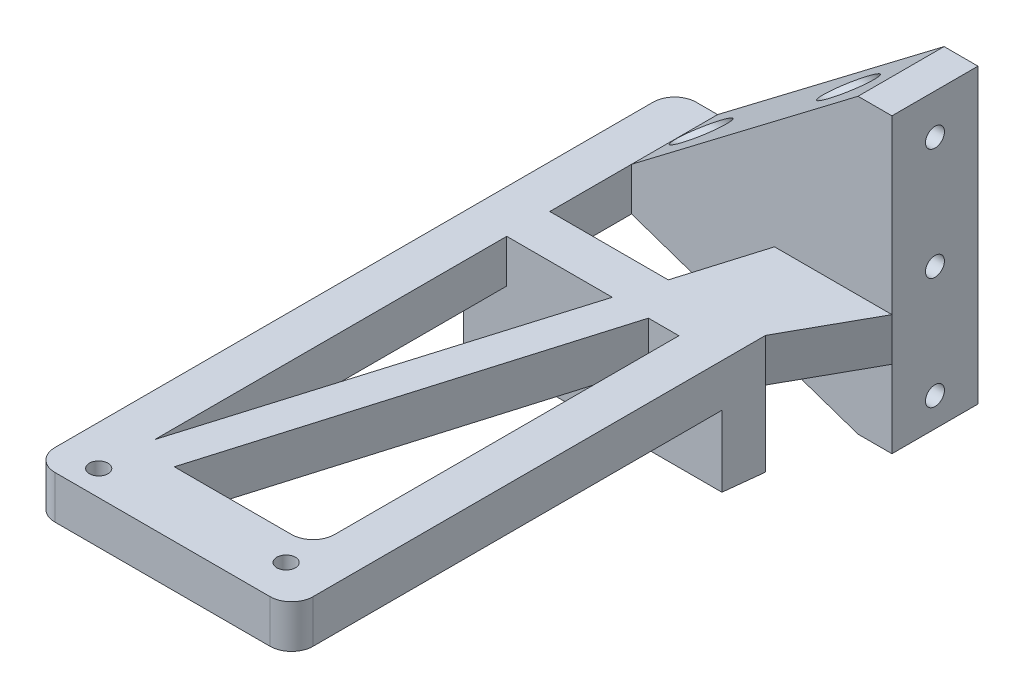
from build123d import *

# Parameters (mm, degrees)
EXTRUDE_1_DEPTH                 = 10
SKETCH_4_W                      = 7.875
SKETCH_4_H                      = 20
EXTRUDE_2_DEPTH                 = 40
CUT_EXTRUDE_1_REACH             = 116.35
SKETCH_5_R                      = 2.2
CUT_EXTRUDE_1_DIRECTION_2_DEPTH = 53
CUT_EXTRUDE_2_REACH             = 107.272
SKETCH_6_R                      = 2.15
FILLET_1_R                      = 5
FILLET_2_R                      = 5
SKETCH_7_W                      = 7.875
SKETCH_7_H                      = 20
EXTRUDE_3_DEPTH                 = 18
CUT_EXTRUDE_3_REACH             = 116.35
SKETCH_8_R                      = 2.2
EXTRUDE_8_DEPTH                 = 20
SKETCH_15_W                     = 52.625
SKETCH_15_H                     = 20
EXTRUDE_9_DEPTH                 = 40
CUT_EXTRUDE_START               = -7.875
SKETCH_14_R                     = 4.5
CUT_EXTRUDE_8_DEPTH             = 54
CUT_EXTRUDE_10_DEPTH            = 20
EXTRUDE_10_DEPTH                = 10
EXTRUDE_11_DEPTH                = 17.5
CUT_EXTRUDE_11_DEPTH            = 64


with BuildPart() as part:
    # 草图1 → 凸台-拉伸1 (new body)
    with BuildSketch(Plane(origin=(0, 0, 0), x_dir=(1, 0, 0), z_dir=(0, 1, 0))):
        Polygon((5.931150433, 81.572237736), (53.180774799, 81.572237736), (53.180774799, 61.572237736), (42.680774799, 42.721022935), (42.680774799, 31.757290204), (42.680774799, -57.600660719), (42.680774799, -67.427762264), (0.431150433, -67.427762264), (-17.319225201, -67.427762264), (-17.319225201, 81.572237736), align=None)
        Polygon((47.930774799, 61.572237736), (42.680774799, 61.572237736), (42.680774799, 52.689495612), align=None, mode=Mode.SUBTRACT)
        Polygon((25.906315323, 61.572237736), (-7.319225201, 61.572237736), (-7.319225201, -49.220735683), align=None, mode=Mode.SUBTRACT)
        Polygon((0.431150433, -52.427762264), (32.680774799, -52.427762264), (32.680774799, 56.508121895), align=None, mode=Mode.SUBTRACT)
    extrude(amount=EXTRUDE_1_DEPTH)

    # 草图4 → 凸台-拉伸2 (add)
    with BuildSketch(Plane(origin=(0, 10, 0), x_dir=(1, 0, 0), z_dir=(0, 1, 0))):
        with Locations((49.243274799, 71.572237736)):
            Rectangle(SKETCH_4_W, SKETCH_4_H)
    extrude(amount=EXTRUDE_2_DEPTH)

    # 草图5 → 切除-拉伸1 (cut, up to next)
    with BuildSketch(Plane.ZY.offset(-45.305774799), mode=Mode.PRIVATE) as cut_extrude_1_sk1:
        with Locations(Location((-71.572237736, 14.7, 0), (0, 0, 180))):
            Circle(SKETCH_5_R)
    cut_extrude_1_tool1 = extrude(cut_extrude_1_sk1.sketch, amount=-CUT_EXTRUDE_1_REACH, mode=Mode.PRIVATE) & part.part
    # 草图5 → 切除-拉伸1 (cut, up to next)
    with BuildSketch(Plane.ZY.offset(-45.305774799), mode=Mode.PRIVATE) as cut_extrude_1_sk2:
        with Locations(Location((-71.572237736, 40.7, 0), (0, 0, 180))):
            Circle(SKETCH_5_R)
    cut_extrude_1_tool2 = extrude(cut_extrude_1_sk2.sketch, amount=-CUT_EXTRUDE_1_REACH, mode=Mode.PRIVATE) & part.part
    add(cut_extrude_1_tool1.solids().sort_by_distance((45.305775, 14.7, -71.572238))[0], mode=Mode.SUBTRACT)
    add(cut_extrude_1_tool2.solids().sort_by_distance((45.305775, 40.7, -71.572238))[0], mode=Mode.SUBTRACT)

    # 草图5 → 切除-拉伸1 direction 2 (cut)
    with BuildSketch(Plane.ZY.offset(-45.305774799)):
        with Locations(Location((-71.572237736, 14.7, 0), (0, 0, 180))):
            Circle(SKETCH_5_R)
        with Locations(Location((-71.572237736, 40.7, 0), (0, 0, 180))):
            Circle(SKETCH_5_R)
    extrude(amount=CUT_EXTRUDE_1_DIRECTION_2_DEPTH, mode=Mode.SUBTRACT)

    # 草图6 → 切除-拉伸2 (cut, up to next)
    with BuildSketch(Plane(origin=(0, 10, 0), x_dir=(1, 0, 0), z_dir=(0, 1, 0)), mode=Mode.PRIVATE) as cut_extrude_2_sk1:
        with Locations(Location((-8.019225201, -61.542634482, 0), (0, 0, 270))):
            Circle(SKETCH_6_R)
    cut_extrude_2_tool1 = extrude(cut_extrude_2_sk1.sketch, amount=-CUT_EXTRUDE_2_REACH, mode=Mode.PRIVATE) & part.part
    # 草图6 → 切除-拉伸2 (cut, up to next)
    with BuildSketch(Plane(origin=(0, 10, 0), x_dir=(1, 0, 0), z_dir=(0, 1, 0)), mode=Mode.PRIVATE) as cut_extrude_2_sk2:
        with Locations(Location((32.680774799, -58.692634482, 0), (0, 0, 270))):
            Circle(SKETCH_6_R)
    cut_extrude_2_tool2 = extrude(cut_extrude_2_sk2.sketch, amount=-CUT_EXTRUDE_2_REACH, mode=Mode.PRIVATE) & part.part
    add(cut_extrude_2_tool1.solids().sort_by_distance((-8.019225, 10, 61.542634))[0], mode=Mode.SUBTRACT)
    add(cut_extrude_2_tool2.solids().sort_by_distance((32.680775, 10, 58.692634))[0], mode=Mode.SUBTRACT)

    # 圆角1
    fillet_1_edges = [part.edges().sort_by_distance(p)[0] for p in [
        (-17.319225201, 5, 67.427762264),
        (-17.319225201, 5, -81.572237736),
        (42.680774799, 5, 67.427762264),
    ]]
    fillet(fillet_1_edges, radius=FILLET_1_R)

    # 圆角2
    fillet_2_edges = [part.edges().sort_by_distance(p)[0] for p in [
        (32.680774799, 5, 52.427762264),
    ]]
    fillet(fillet_2_edges, radius=FILLET_2_R)

    # 草图7 → 凸台-拉伸3 (add)
    with BuildSketch(Plane.XZ):
        with Locations((49.243274799, -71.572237736)):
            Rectangle(SKETCH_7_W, SKETCH_7_H)
    extrude(amount=EXTRUDE_3_DEPTH)

    # 草图8 → 切除-拉伸3 (cut, up to next)
    with BuildSketch(Plane.ZY.offset(-45.305774799), mode=Mode.PRIVATE) as cut_extrude_3_sk1:
        with Locations((-71.572237736, -11.3)):
            Circle(SKETCH_8_R)
    cut_extrude_3_tool1 = extrude(cut_extrude_3_sk1.sketch, amount=-CUT_EXTRUDE_3_REACH, mode=Mode.PRIVATE) & part.part
    add(cut_extrude_3_tool1.solids().sort_by_distance((45.305775, -11.3, -71.572238))[0], mode=Mode.SUBTRACT)

    # 草图13 → 凸台-拉伸8 (add)
    with BuildSketch(Plane.XY.offset(-61.572237736)):
        Polygon((45.305774799, 0), (45.305774799, -18), (-7.319225201, 0), align=None)
    extrude(amount=-EXTRUDE_8_DEPTH)

    # 草图15 → 凸台-拉伸9 (add)
    with BuildSketch(Plane(origin=(0, 10, 0), x_dir=(1, 0, 0), z_dir=(0, 1, 0))):
        with Locations((18.993274799, 71.572237736)):
            Rectangle(SKETCH_15_W, SKETCH_15_H)
    extrude(amount=EXTRUDE_9_DEPTH)

    # 草图14 → 切除-拉伸8 (cut)
    with BuildSketch(Plane(origin=(53.180774799, 0, 0), x_dir=(0, 0, -1), z_dir=(1, 0, 0)).offset(CUT_EXTRUDE_START)):
        with Locations((71.572237736, 40.7)):
            Circle(SKETCH_14_R)
        with Locations((71.572237736, 14.7)):
            Circle(SKETCH_14_R)
        with Locations((71.572237736, -11.3)):
            Circle(SKETCH_14_R)
    extrude(amount=-CUT_EXTRUDE_8_DEPTH, mode=Mode.SUBTRACT)

    # 草图17 → 切除-拉伸10 (cut)
    with BuildSketch(Plane.XY.offset(-61.572237736)):
        Polygon((-7.319225201, 10), (-7.319225201, 50), (45.305774799, 50), align=None)
    extrude(amount=-CUT_EXTRUDE_10_DEPTH, mode=Mode.SUBTRACT)

    # 草图18 → 凸台-拉伸10 (add)
    with BuildSketch(Plane(origin=(0, 10, 0), x_dir=(1, 0, 0), z_dir=(0, 1, 0))):
        Polygon((-7.319225201, 32.572237736), (17.209548321, 32.572237736), (20.208433494, 42.572237736), (-7.319225201, 42.572237736), align=None)
        Polygon((25.594741772, 32.572237736), (32.680774799, 32.572237736), (32.680774799, 56.508121895), align=None)
        Polygon((42.680774799, 61.572237736), (42.680774799, 52.689495612), (47.930774799, 61.572237736), align=None)
    extrude(amount=-EXTRUDE_10_DEPTH)

    # 草图19 → 凸台-拉伸11 (add)
    with BuildSketch(Plane.XZ):
        Polygon((-17.319225201, -32.572237736), (-17.319225201, -42.572237736), (42.680774799, -42.721022935), (42.680774799, -32.572237736), align=None)
    extrude(amount=EXTRUDE_11_DEPTH)

    # 草图20 → 切除-拉伸11 (cut)
    with BuildSketch(Plane.ZY.offset(17.319225201)):
        Polygon((-42.572237736, -17.5), (-32.572237736, -17.5), (-32.572237736, -16.5), align=None)
    extrude(amount=-CUT_EXTRUDE_11_DEPTH, mode=Mode.SUBTRACT)


solid = part.part
